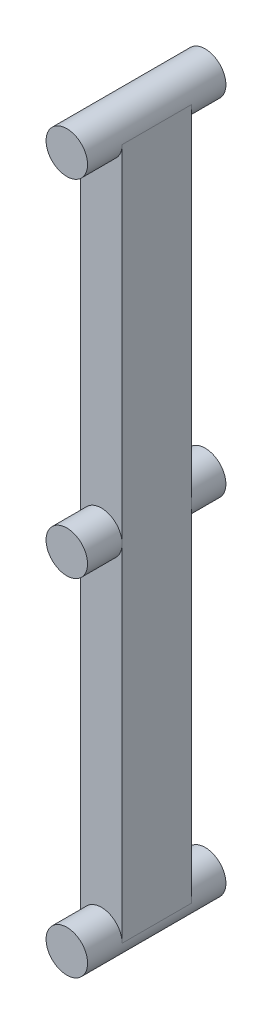
from build123d import *

# Parameters (mm, degrees)
SALIENTE_EXTRUIR1_DEPTH      = 2.5
SALIENTE_EXTRUIR1_DEPTH_BACK = 2.5
CROQUIS1_W                   = 3
CROQUIS1_H                   = 50
SALIENTE_EXTRUIR2_DEPTH      = 5
SALIENTE_EXTRUIR2_DEPTH_BACK = 5
CROQUIS1_3_R                 = 1.5


with BuildPart() as part:
    # Croquis1 → Saliente-Extruir1 (new, two sides: drawn at the far end of the back side and taken through both)
    with BuildSketch(Plane.XY.offset(-SALIENTE_EXTRUIR1_DEPTH_BACK)):
        Rectangle(CROQUIS1_W, CROQUIS1_H)
    extrude(amount=SALIENTE_EXTRUIR1_DEPTH + SALIENTE_EXTRUIR1_DEPTH_BACK)

    # Croquis1<3> → Saliente-Extruir2 (add, two sides: drawn at the far end of the back side and taken through both)
    with BuildSketch(Plane.XY.offset(-SALIENTE_EXTRUIR2_DEPTH_BACK)):
        with Locations((0, 25)):
            Circle(CROQUIS1_3_R)
        with Locations((0, -25)):
            Circle(CROQUIS1_3_R)
        Circle(CROQUIS1_3_R)
    extrude(amount=SALIENTE_EXTRUIR2_DEPTH + SALIENTE_EXTRUIR2_DEPTH_BACK)


solid = part.part
